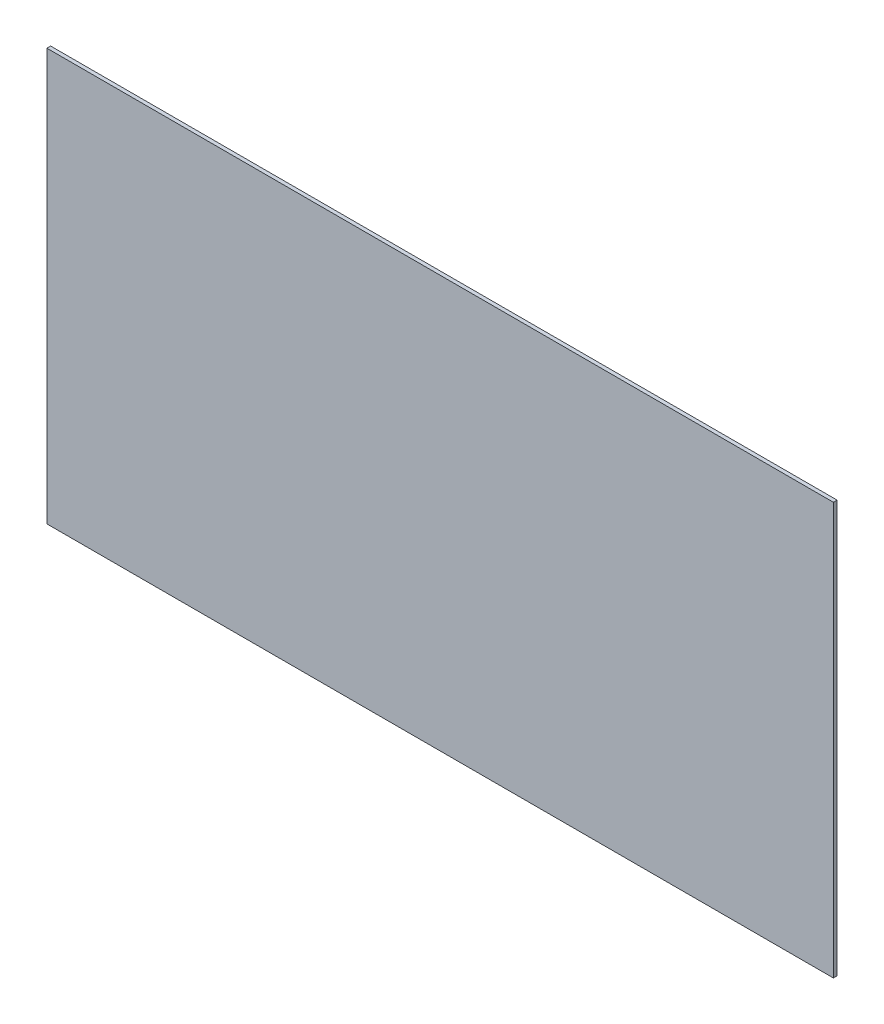
from build123d import *

# Parameters (mm, degrees)
ESQUISSE1_W        = 630
ESQUISSE1_H        = 330
BOSS_EXTRU_1_DEPTH = 3


with BuildPart() as part:
    # Esquisse1 → Boss.-Extru.1 (new body)
    with BuildSketch(Plane.XY):
        with Locations((315, 165)):
            Rectangle(ESQUISSE1_W, ESQUISSE1_H)
    extrude(amount=BOSS_EXTRU_1_DEPTH)


solid = part.part
